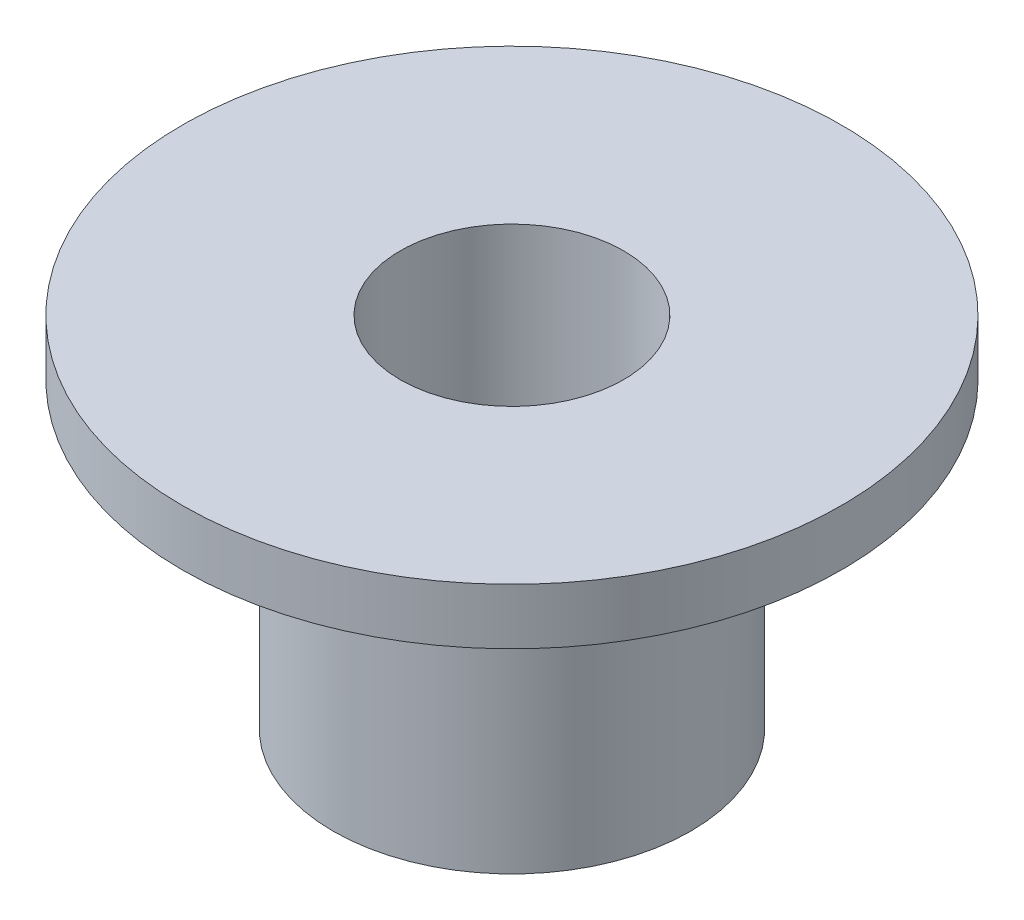
from build123d import *
from build123d.topology import SkipClean

# Parameters (mm, degrees)
SKETCH1_R           = 29.5
SKETCH1_R_2         = 10
BOSS_EXTRUDE1_DEPTH = 5
BOSS_EXTRUDE2_START = 27
SKETCH2_R           = 16
SKETCH2_R_2         = 10
BOSS_EXTRUDE2_DEPTH = 27


with BuildPart() as part:
    # Sketch1 → Boss-Extrude1 (new body)
    with BuildSketch(Plane(origin=(0, 0, 0), x_dir=(1, 0, 0), z_dir=(0, 1, 0))):
        with Locations(Location((0, 0, 0), (0, 0, 270))):
            Circle(SKETCH1_R)
        with Locations(Location((0, 0, 0), (0, 0, 270))):
            Circle(SKETCH1_R_2, mode=Mode.SUBTRACT)
    extrude(amount=BOSS_EXTRUDE1_DEPTH)

    # Sketch2 → Boss-Extrude2 (add)
    with SkipClean():  # the faces are left unmerged after this step: merging them gives an invalid solid
        with BuildSketch(Plane(origin=(0, 0, 0), x_dir=(-1, 0, 0), z_dir=(0, -1, 0)).offset(BOSS_EXTRUDE2_START)):
            with Locations(Location((0, 0, 0), (0, 0, 270))):
                Circle(SKETCH2_R)
            with Locations(Location((0, 0, 0), (0, 0, 90))):
                Circle(SKETCH2_R_2, mode=Mode.SUBTRACT)
        extrude(amount=-BOSS_EXTRUDE2_DEPTH)


solid = part.part
